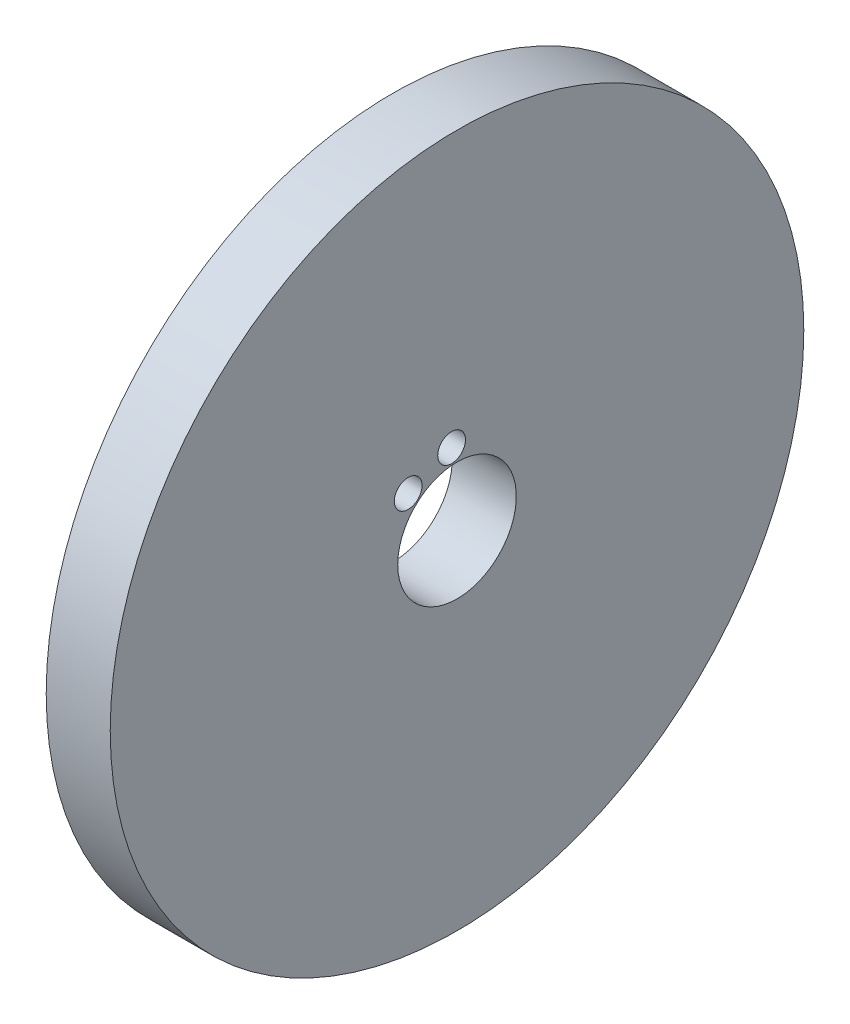
from build123d import *

# Parameters (mm, degrees)
AXIAL_PROFILE_MM_W     = 12
AXIAL_PROFILE_MM_H     = 53.8875
AXIAL_HOLES_DEPTH      = 96.448886845
AXIAL_HOLES_DEPTH_BACK = 96.448886845
SKETCH2_R              = 2.6


with BuildPart() as part:
    # Axial profile (mm) → Full revolution (revolve)
    with BuildSketch(Plane.XY, mode=Mode.PRIVATE) as full_revolution_sk:
        with Locations((19.7, 38.05625)):
            Rectangle(AXIAL_PROFILE_MM_W, AXIAL_PROFILE_MM_H)
    revolve(full_revolution_sk.sketch.rotate(Axis((-110, 0, 0), (1, 0, 0)), 90), axis=Axis((-110, 0, 0), (1, 0, 0)))

    # Sketch2 → Axial holes (cut, two sides: drawn at the far end of the back side and taken through both)
    with BuildSketch(Plane(origin=(0, 0, 0), x_dir=(0, 0, -1), z_dir=(1, 0, 0)).offset(-AXIAL_HOLES_DEPTH_BACK)):
        with Locations(Location((-1.016890853, 13.963020196, 0), (0, 0, 180))):
            Circle(SKETCH2_R)
        with Locations(Location((-9.154295848, 10.592396684, 0), (0, 0, 180))):
            Circle(SKETCH2_R)
    extrude(amount=AXIAL_HOLES_DEPTH + AXIAL_HOLES_DEPTH_BACK, mode=Mode.SUBTRACT)


solid = part.part
